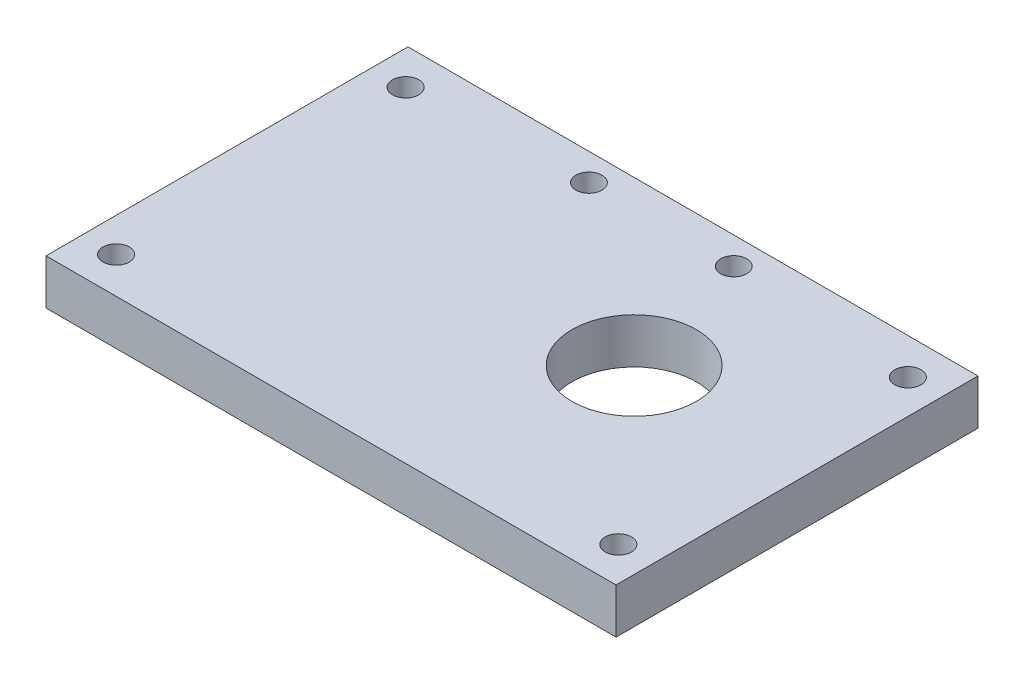
from build123d import *

# Parameters (mm, degrees)
SKETCH1_W           = 80.01
SKETCH1_H           = 50.8
BOSS_EXTRUDE1_DEPTH = 6.35
SKETCH2_R           = 1.8415
CUT_EXTRUDE1_DEPTH  = 48.81090383
SKETCH3_R           = 8.73125
SKETCH3_R_2         = 1.8288
CUT_EXTRUDE2_DEPTH  = 48.81090383


with BuildPart() as part:
    # Sketch1 → Boss-Extrude1 (new body)
    with BuildSketch(Plane(origin=(0, 0, 0), x_dir=(1, 0, 0), z_dir=(0, 1, 0))):
        Rectangle(SKETCH1_W, SKETCH1_H)
    extrude(amount=BOSS_EXTRUDE1_DEPTH)

    # Sketch2 → Cut-Extrude1 (cut, through all)
    with BuildSketch(Plane(origin=(0, 6.35, 0), x_dir=(1, 0, 0), z_dir=(0, 1, 0))):
        with Locations(Location((-35.2425, 20.32, 0), (0, 0, 270))):
            Circle(SKETCH2_R)
        with Locations(Location((-35.2425, -20.32, 0), (0, 0, 270))):
            Circle(SKETCH2_R)
        with Locations(Location((35.2425, -20.32, 0), (0, 0, 270))):
            Circle(SKETCH2_R)
        with Locations(Location((35.2425, 20.32, 0), (0, 0, 270))):
            Circle(SKETCH2_R)
    extrude(amount=-CUT_EXTRUDE1_DEPTH, mode=Mode.SUBTRACT)

    # Sketch3 → Cut-Extrude2 (cut, through all)
    with BuildSketch(Plane(origin=(0, 6.35, 0), x_dir=(1, 0, 0), z_dir=(0, 1, 0))):
        with Locations(Location((14.605, 2.54, 0), (0, 0, 270))):
            Circle(SKETCH3_R)
        with Locations(Location((-10.795, 21.59, 0), (0, 0, 270))):
            Circle(SKETCH3_R_2)
        with Locations(Location((9.525, 21.59, 0), (0, 0, 270))):
            Circle(SKETCH3_R_2)
    extrude(amount=-CUT_EXTRUDE2_DEPTH, mode=Mode.SUBTRACT)


solid = part.part
